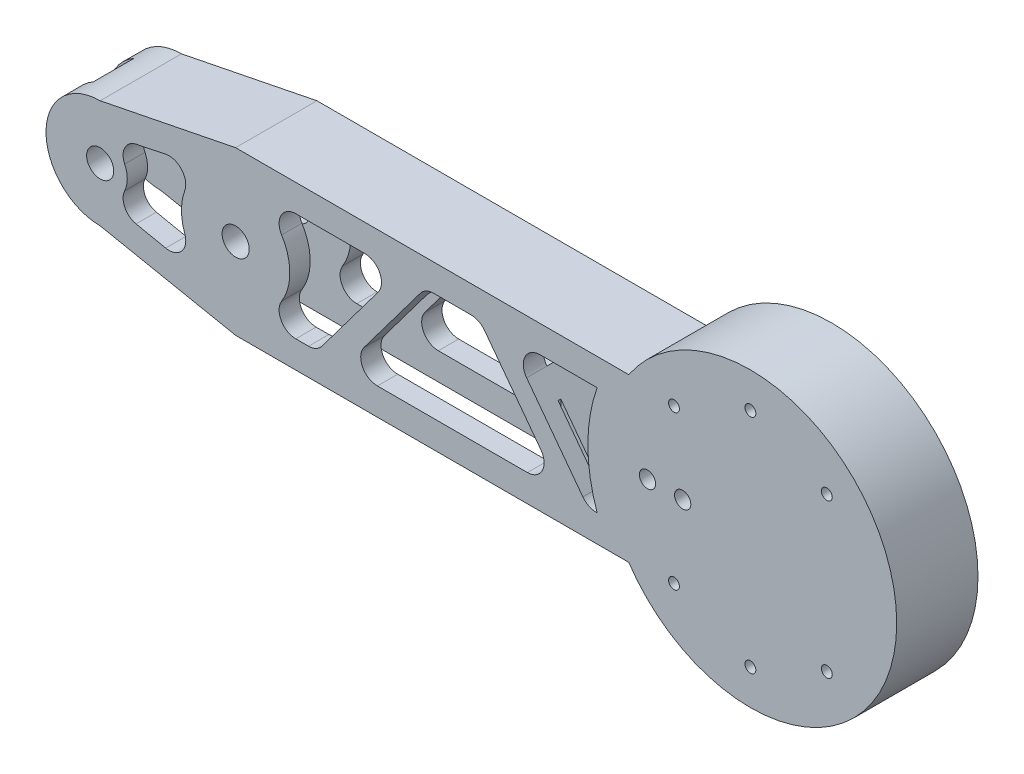
from build123d import *

# Parameters (mm, degrees)
EXTRUDE_1_DEPTH          = 60
EXTRUDE_1_DEPTH_BACK     = 70
EXTRUDE_2_DEPTH          = 7.5
EXTRUDE_2_DEPTH_BACK     = 7.5
SKETCH_2_R               = 27
SKETCH_2_R_2             = 23.5
CUT_EXTRUDE_1_DEPTH      = 7.5
CUT_EXTRUDE_1_DEPTH_BACK = 7.5
SKETCH_3_R               = 24.5
SKETCH_4_R               = 24.5
EXTRUDE_3_DEPTH          = 3
EXTRUDE_4_DEPTH          = 2.58
SKETCH_6_R               = 1
CUT_EXTRUDE_2_DEPTH      = 3
SKETCH_7_R               = 1.5
CUT_EXTRUDE_3_DEPTH      = 5.58
CUT_EXTRUDE_4_DEPTH      = 97
CUT_EXTRUDE_5_DEPTH      = 1
CUT_EXTRUDE_5_DEPTH_BACK = 15
CUT_EXTRUDE_6_DEPTH      = 92.401586419
CUT_EXTRUDE_6_DEPTH_BACK = 7.5
SKETCH_10_R              = 2.5
EXTRUDE_6_DEPTH          = 4
EXTRUDE_6_DEPTH_BACK     = 4
EXTRUDE_7_DEPTH          = 4
EXTRUDE_7_DEPTH_BACK     = 4


with BuildPart() as part:
    # 草图1 → 凸台-拉伸1 (new, two sides: drawn at the far end of the back side and taken through both)
    with BuildSketch(Plane(origin=(0, 0, 0), x_dir=(0, 0, -1), z_dir=(1, 0, 0)).offset(-EXTRUDE_1_DEPTH_BACK)):
        Polygon((7.5, 0), (7.5, 15), (-7.5, 15), (-7.5, -15), (7.5, -15), align=None)
    extrude(amount=EXTRUDE_1_DEPTH + EXTRUDE_1_DEPTH_BACK)

    # 草图2 → 凸台-拉伸2 (add, two sides: drawn at the far end of the back side and taken through both)
    with BuildSketch(Plane.XY.offset(-EXTRUDE_2_DEPTH_BACK)):
        with Locations((60, 0)):
            Circle(SKETCH_2_R)
        with Locations((60, 0)):
            Circle(SKETCH_2_R_2, mode=Mode.SUBTRACT)
    extrude(amount=EXTRUDE_2_DEPTH + EXTRUDE_2_DEPTH_BACK)

    # 草图3 → 切除-拉伸1 (cut, two sides: drawn at the far end of the back side and taken through both)
    with BuildSketch(Plane.XY.offset(-CUT_EXTRUDE_1_DEPTH_BACK)):
        with Locations((60, 0)):
            Circle(SKETCH_3_R)
    extrude(amount=CUT_EXTRUDE_1_DEPTH + CUT_EXTRUDE_1_DEPTH_BACK, mode=Mode.SUBTRACT)

    # 草图4 → 凸台-拉伸3 (add)
    with BuildSketch(Plane.XY.offset(7.5)):
        with Locations((60, 0)):
            Circle(SKETCH_4_R)
    extrude(amount=-EXTRUDE_3_DEPTH)

    # 草图5 → 凸台-拉伸4 (add)
    with BuildSketch(Plane(origin=(0, 0, 4.5), x_dir=(-1, 0, 0), z_dir=(0, 0, -1))):
        Polygon((-36.5, 0), (-36.5, 4), (-40.5, 4), (-45.5, 4), (-50.5, 4), (-50.5, 0), (-50.5, -4), (-36.5, -4), align=None)
    extrude(amount=EXTRUDE_4_DEPTH)

    # 草图6 → 切除-拉伸2 (cut)
    with BuildSketch(Plane(origin=(0, 0, 4.5), x_dir=(-1, 0, 0), z_dir=(0, 0, -1))):
        with Locations((-60, 20.5)):
            Circle(SKETCH_6_R)
        with Locations((-60, -20.5)):
            Circle(SKETCH_6_R)
        with Locations((-45.894936823, 14.179111142)):
            Circle(SKETCH_6_R)
        with Locations((-74.105063177, 14.179111142)):
            Circle(SKETCH_6_R)
        with Locations((-74.105063177, -14.179111142)):
            Circle(SKETCH_6_R)
        with Locations((-45.894936823, -14.179111142)):
            Circle(SKETCH_6_R)
    extrude(amount=-CUT_EXTRUDE_2_DEPTH, mode=Mode.SUBTRACT)

    # 草图7 → 切除-拉伸3 (cut)
    with BuildSketch(Plane(origin=(0, 0, 1.92), x_dir=(-1, 0, 0), z_dir=(0, 0, -1))):
        with Locations((-47.5, 0)):
            Circle(SKETCH_7_R)
        with Locations((-41, 0)):
            Circle(SKETCH_7_R)
    extrude(amount=-CUT_EXTRUDE_3_DEPTH, mode=Mode.SUBTRACT)

    # 草图8 → 切除-拉伸4 (cut)
    with BuildSketch(Plane.ZY.offset(70)):
        Polygon((0, 15), (-3.75, 15), (-3.75, -15), (3.75, -15), (3.75, 15), align=None)
    extrude(amount=-CUT_EXTRUDE_4_DEPTH, mode=Mode.SUBTRACT)

    # 草图9 → 切除-拉伸5 (cut, two sides: drawn at the far end of the back side and taken through both)
    with BuildSketch(Plane(origin=(36.5, 0, 0), x_dir=(0, 0, -1), z_dir=(1, 0, 0)).offset(-CUT_EXTRUDE_5_DEPTH_BACK)):
        Polygon((3.75, -9.1), (3.75, 0), (3.75, 9.1), (-4.5, 9.1), (-4.5, -9.1), align=None)
    extrude(amount=CUT_EXTRUDE_5_DEPTH + CUT_EXTRUDE_5_DEPTH_BACK, mode=Mode.SUBTRACT)

    # 草图10 → 切除-拉伸6 (cut, two sides: drawn at the far end of the back side and taken through both)
    with BuildSketch(Plane.XY.offset(-CUT_EXTRUDE_6_DEPTH_BACK)):
        with BuildLine():
            ThreePointArc((-60, -10), (-67.071067841, -7.071067782), (-70, 8.3e-08))
            Line((-70, 8.3e-08), (-70, -15))
            Line((-70, -15), (-35, -15))
            Line((-35, -15), (-60, -10))
        make_face()
        with BuildLine():
            Line((-60, 10), (-35, 15))
            Line((-35, 15), (-70, 15))
            Line((-70, 15), (-70, 8.3e-08))
            ThreePointArc((-70, 8.3e-08), (-67.071067782, 7.071067841), (-60, 10))
        make_face()
        with BuildLine():
            Line((-47.910318504, 7.502760494), (-53.381882594, 6.370057829))
            ThreePointArc((-53.381882594, 6.370057829), (-55.459731516, 4.768530579), (-55.483580368, 2.145216472))
            ThreePointArc((-55.483580368, 2.145216472), (-55, 0), (-55.483580368, -2.145216472))
            ThreePointArc((-55.483580368, -2.145216472), (-55.459731516, -4.768530579), (-53.381882594, -6.370057829))
            Line((-53.381882594, -6.370057829), (-47.910318504, -7.502760494))
            ThreePointArc((-47.910318504, -7.502760494), (-44.955257563, -6.500012961), (-44.393173811, -3.430493514))
            ThreePointArc((-44.393173811, -3.430493514), (-45, 0), (-44.393173811, 3.430493514))
            ThreePointArc((-44.393173811, 3.430493514), (-44.955257563, 6.500012961), (-47.910318504, 7.502760494))
        make_face()
        with BuildLine():
            Line((-11.159432091, 10), (-23.900962122, 10))
            ThreePointArc((-23.900962122, 10), (-26.593808125, 8.414683944), (-26.514312819, 5.290851828))
            ThreePointArc((-26.514312819, 5.290851828), (-25, 0), (-26.514312819, -5.290851828))
            ThreePointArc((-26.514312819, -5.290851828), (-26.593808125, -8.414683944), (-23.900962122, -10))
            Line((-23.900962122, -10), (-21.539858023, -10))
            ThreePointArc((-21.539858023, -10), (-20.162567137, -9.674865726), (-19.076085186, -8.768113582))
            Line((-19.076085186, -8.768113582), (-8.695659254, 5.072454327))
            ThreePointArc((-8.695659254, 5.072454327), (-8.404850319, 8.29757484), (-11.159432091, 10))
        make_face()
        with BuildLine():
            Line((-0.923914814, 8.768113582), (-11.304340746, -5.072454327))
            ThreePointArc((-11.304340746, -5.072454327), (-11.595149681, -8.29757484), (-8.840567909, -10))
            Line((-8.840567909, -10), (18.840567909, -10))
            ThreePointArc((18.840567909, -10), (21.595149681, -8.29757484), (21.304340746, -5.072454327))
            Line((21.304340746, -5.072454327), (10.923914814, 8.768113582))
            ThreePointArc((10.923914814, 8.768113582), (9.837432863, 9.674865726), (8.460141977, 10))
            Line((8.460141977, 10), (1.539858023, 10))
            ThreePointArc((1.539858023, 10), (0.162567137, 9.674865726), (-0.923914814, 8.768113582))
        make_face()
        with BuildLine():
            ThreePointArc((21.159432091, 10), (18.404850319, 8.29757484), (18.695659254, 5.072454327))
            Line((18.695659254, 5.072454327), (29.076085186, -8.768113582))
            ThreePointArc((29.076085186, -8.768113582), (30.162567137, -9.674865726), (31.539858023, -10))
            Line((31.539858023, -10), (31.715728753, -10))
            ThreePointArc((31.715728753, -10), (30, 0), (31.715728753, 10))
            Line((31.715728753, 10), (21.159432091, 10))
        make_face()
        with Locations((-60, 0)):
            Circle(SKETCH_10_R)
        with Locations((-35, 0)):
            Circle(SKETCH_10_R)
    extrude(amount=CUT_EXTRUDE_6_DEPTH + CUT_EXTRUDE_6_DEPTH_BACK, mode=Mode.SUBTRACT)

    # 草图12 → 凸台-拉伸6 (add, two sides: drawn at the far end of the back side and taken through both)
    with BuildSketch(Plane.XY.offset(-EXTRUDE_6_DEPTH_BACK)):
        Polygon((18.695659254, 5.072454327), (13.695659254, 5.072454327), (24.981384918, -9.975179891), (29.981384918, -9.975179891), align=None)
        with BuildLine():
            ThreePointArc((-8.695659254, 8.768113582), (-8.079716045, 6.920283955), (-8.695659254, 5.072454327))
            Line((-8.695659254, 5.072454327), (-13.88587222, -1.847829627))
            Line((-13.88587222, -1.847829627), (-3.362056873, 5.517257503))
            Line((-3.362056873, 5.517257503), (-0.923914814, 8.768113582))
            Line((-0.923914814, 8.768113582), (-8.695659254, 8.768113582))
        make_face()
    extrude(amount=EXTRUDE_6_DEPTH + EXTRUDE_6_DEPTH_BACK)

    # 草图11 → 凸台-拉伸7 (add, two sides: drawn at the far end of the back side and taken through both)
    with BuildSketch(Plane.XY.offset(-EXTRUDE_7_DEPTH_BACK)):
        with BuildLine():
            Line((-65, 8.660254038), (-63.75, 6.495190528))
            ThreePointArc((-63.75, 6.495190528), (-61.941142838, 7.244443697), (-60, 7.5))
            Line((-60, 7.5), (-34.519230769, 12.596153846))
            Line((-34.519230769, 12.596153846), (32.772497208, 12.596153846))
            ThreePointArc((32.772497208, 12.596153846), (33.368731111, 13.812151076), (34.019237886, 15))
            Line((34.019237886, 15), (-35, 15))
            Line((-35, 15), (-60, 10))
            ThreePointArc((-60, 10), (-62.588190451, 9.659258263), (-65, 8.660254038))
        make_face()
    extrude(amount=EXTRUDE_7_DEPTH + EXTRUDE_7_DEPTH_BACK)


solid = part.part
